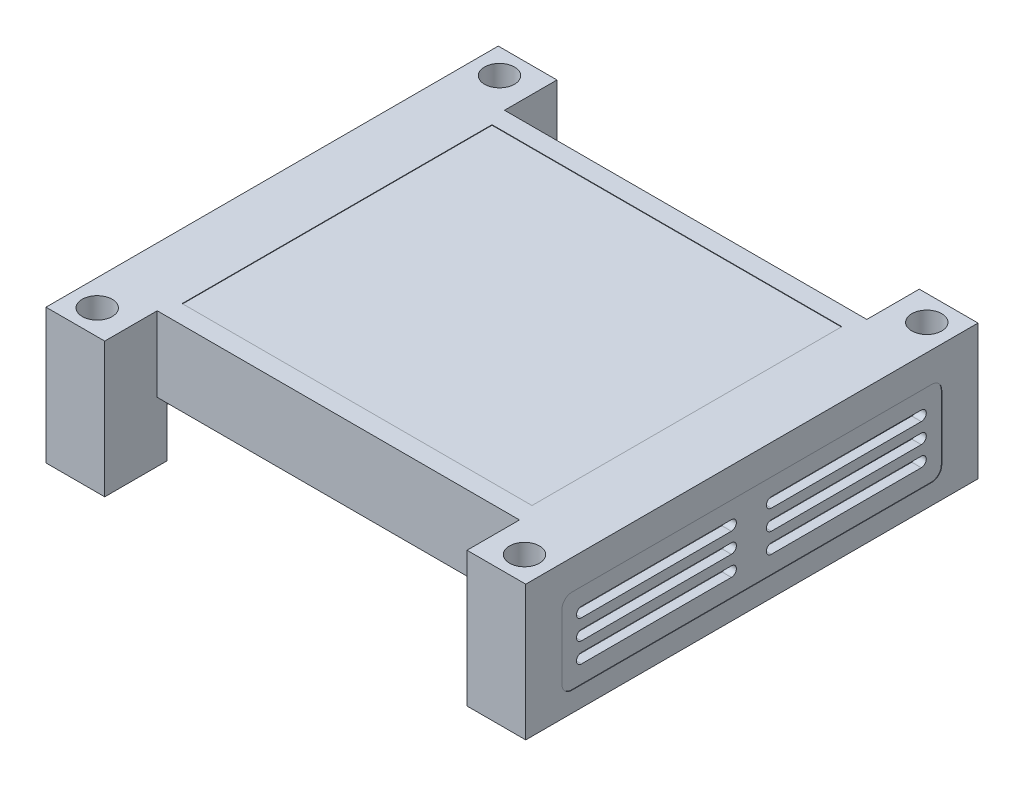
from build123d import *

# Parameters (mm, degrees)
BOSS_EXTRUDE1_DEPTH  = 25
BOSS_EXTRUDE2_DEPTH  = 2
SKETCH3_W            = 72.5
SKETCH3_H            = 18.058244084
CUT_EXTRUDE1_DEPTH   = 90
SKETCH4_R            = 3.5
BOSS_EXTRUDE9_DEPTH  = 28.5
SKETCH5_R            = 1.5
CUT_EXTRUDE2_DEPTH   = 28.5
SKETCH6_R            = 3
CUT_EXTRUDE3_DEPTH   = 27
SKETCH7_W            = 70
SKETCH7_H            = 62
CUT_EXTRUDE4_DEPTH   = 0.1
SKETCH8_W            = 76
SKETCH8_H            = 17
CUT_EXTRUDE5_DEPTH   = 0.1
FILLET1_R            = 2
CUT_EXTRUDE6_DEPTH   = 5
FILLET1_OF_MIRROR1_R = 2


with BuildPart() as part:
    # Sketch1 → Boss-Extrude1 (new body)
    with BuildSketch(Plane(origin=(0, 0, 0), x_dir=(1, 0, 0), z_dir=(0, 1, 0))):
        Polygon((-48, 45.25), (-36.25, 45.25), (-36.25, 34.75), (36.25, 34.75), (36.25, 45.25), (48, 45.25), (48, -45.25), (36.25, -45.25), (36.25, -34.75), (-36.25, -34.75), (-36.25, -45.25), (-48, -45.25), align=None)
        Polygon((-46, 43.25), (-38.25, 43.25), (-38.25, 32.75), (38.25, 32.75), (38.25, 43.25), (46, 43.25), (46, -43.25), (38.25, -43.25), (38.25, -32.75), (-38.25, -32.75), (-38.25, -43.25), (-46, -43.25), align=None, mode=Mode.SUBTRACT)
    extrude(amount=BOSS_EXTRUDE1_DEPTH)

    # Sketch2 → Boss-Extrude2 (add)
    with BuildSketch(Plane(origin=(0, 25, 0), x_dir=(1, 0, 0), z_dir=(0, 1, 0))):
        Polygon((36.25, -45.25), (48, -45.25), (48, 45.25), (36.25, 45.25), (36.25, 34.75), (-36.25, 34.75), (-36.25, 45.25), (-48, 45.25), (-48, -45.25), (-36.25, -45.25), (-36.25, -34.75), (36.25, -34.75), align=None)
    extrude(amount=BOSS_EXTRUDE2_DEPTH)

    # Sketch3 → Cut-Extrude1 (cut)
    with BuildSketch(Plane.XY.offset(34.75)):
        with Locations((0, 2.970877958)):
            Rectangle(SKETCH3_W, SKETCH3_H)
    extrude(amount=-CUT_EXTRUDE1_DEPTH, mode=Mode.SUBTRACT)

    # Sketch4 → Boss-Extrude9 (add)
    with BuildSketch(Plane(origin=(0, 27, 0), x_dir=(1, 0, 0), z_dir=(0, 1, 0))):
        with Locations(Location((-42.75, 40.25, 0), (0, 0, 270))):
            Circle(SKETCH4_R)
        with Locations(Location((42.75, 40.25, 0), (0, 0, 270))):
            Circle(SKETCH4_R)
        with Locations(Location((42.75, -40.25, 0), (0, 0, 270))):
            Circle(SKETCH4_R)
        with Locations(Location((-42.75, -40.25, 0), (0, 0, 270))):
            Circle(SKETCH4_R)
    extrude(amount=-BOSS_EXTRUDE9_DEPTH)

    # Sketch5 → Cut-Extrude2 (cut)
    with BuildSketch(Plane.XZ.offset(1.5)):
        with Locations(Location((-42.75, 40.25, 0), (0, 0, 270))):
            Circle(SKETCH5_R)
        with Locations(Location((42.75, 40.25, 0), (0, 0, 270))):
            Circle(SKETCH5_R)
        with Locations(Location((42.75, -40.25, 0), (0, 0, 270))):
            Circle(SKETCH5_R)
        with Locations(Location((-42.75, -40.25, 0), (0, 0, 270))):
            Circle(SKETCH5_R)
    extrude(amount=-CUT_EXTRUDE2_DEPTH, mode=Mode.SUBTRACT)

    # Sketch6 → Cut-Extrude3 (cut)
    with BuildSketch(Plane(origin=(0, 27, 0), x_dir=(1, 0, 0), z_dir=(0, 1, 0))):
        with Locations(Location((-42.75, 40.25, 0), (0, 0, 270))):
            Circle(SKETCH6_R)
        with Locations(Location((42.75, 40.25, 0), (0, 0, 90))):
            Circle(SKETCH6_R)
        with Locations(Location((42.75, -40.25, 0), (0, 0, 270))):
            Circle(SKETCH6_R)
        with Locations(Location((-42.75, -40.25, 0), (0, 0, 90))):
            Circle(SKETCH6_R)
    extrude(amount=-CUT_EXTRUDE3_DEPTH, mode=Mode.SUBTRACT)

    # Sketch7 → Cut-Extrude4 (cut)
    with BuildSketch(Plane(origin=(0, 27, 0), x_dir=(1, 0, 0), z_dir=(0, 1, 0))):
        Rectangle(SKETCH7_W, SKETCH7_H)
    extrude(amount=-CUT_EXTRUDE4_DEPTH, mode=Mode.SUBTRACT)

    # Sketch8 → Cut-Extrude5 (cut)
    with BuildSketch(Plane.ZY.offset(48)):
        with Locations((0, 12.5)):
            Rectangle(SKETCH8_W, SKETCH8_H)
    cut_extrude5 = extrude(amount=-CUT_EXTRUDE5_DEPTH, mode=Mode.SUBTRACT)

    # Fillet1
    fillet1_edges = [part.edges().sort_by_distance(p)[0] for p in [
        (-47.95, 21, 38),
        (-47.95, 4, 38),
        (-47.95, 4, -38),
        (-47.95, 21, -38),
    ]]
    fillet(fillet1_edges, radius=FILLET1_R)

    # Sketch9 → Cut-Extrude6 (cut)
    with BuildSketch(Plane.ZY.offset(47.9)):
        with BuildLine():
            Line((-34, 13.5), (-4, 13.5))
            ThreePointArc((-4, 13.5), (-3, 12.5), (-4, 11.5))
            Line((-4, 11.5), (-34, 11.5))
            ThreePointArc((-34, 11.5), (-35, 12.5), (-34, 13.5))
        make_face()
        with BuildLine():
            Line((-34, 17.5), (-4, 17.5))
            ThreePointArc((-4, 17.5), (-3, 16.5), (-4, 15.5))
            Line((-4, 15.5), (-34, 15.5))
            ThreePointArc((-34, 15.5), (-35, 16.5), (-34, 17.5))
        make_face()
        with BuildLine():
            Line((-34, 9.5), (-4, 9.5))
            ThreePointArc((-4, 9.5), (-3, 8.5), (-4, 7.5))
            Line((-4, 7.5), (-34, 7.5))
            ThreePointArc((-34, 7.5), (-35, 8.5), (-34, 9.5))
        make_face()
        with BuildLine():
            Line((34, 9.5), (4, 9.5))
            ThreePointArc((4, 9.5), (3, 8.5), (4, 7.5))
            Line((4, 7.5), (34, 7.5))
            ThreePointArc((34, 7.5), (35, 8.5), (34, 9.5))
        make_face()
        with BuildLine():
            Line((34, 13.5), (4, 13.5))
            ThreePointArc((4, 13.5), (3, 12.5), (4, 11.5))
            Line((4, 11.5), (34, 11.5))
            ThreePointArc((34, 11.5), (35, 12.5), (34, 13.5))
        make_face()
        with BuildLine():
            Line((34, 17.5), (4, 17.5))
            ThreePointArc((4, 17.5), (3, 16.5), (4, 15.5))
            Line((4, 15.5), (34, 15.5))
            ThreePointArc((34, 15.5), (35, 16.5), (34, 17.5))
        make_face()
    cut_extrude6 = extrude(amount=-CUT_EXTRUDE6_DEPTH, mode=Mode.SUBTRACT)

    # Mirror1: Cut-Extrude5, Cut-Extrude6 across plane
    add(cut_extrude5.mirror(Plane(origin=(0, 0, 0), x_dir=(0, 0, 1), z_dir=(1, 0, 0))), mode=Mode.SUBTRACT)
    add(cut_extrude6.mirror(Plane(origin=(0, 0, 0), x_dir=(0, 0, 1), z_dir=(1, 0, 0))), mode=Mode.SUBTRACT)

    # Fillet1 of Mirror1
    fillet1_of_mirror1_edges = [part.edges().sort_by_distance(p)[0] for p in [
        (47.95, 21, 38),
        (47.95, 4, 38),
        (47.95, 4, -38),
        (47.95, 21, -38),
    ]]
    fillet(fillet1_of_mirror1_edges, radius=FILLET1_OF_MIRROR1_R)


solid = part.part
